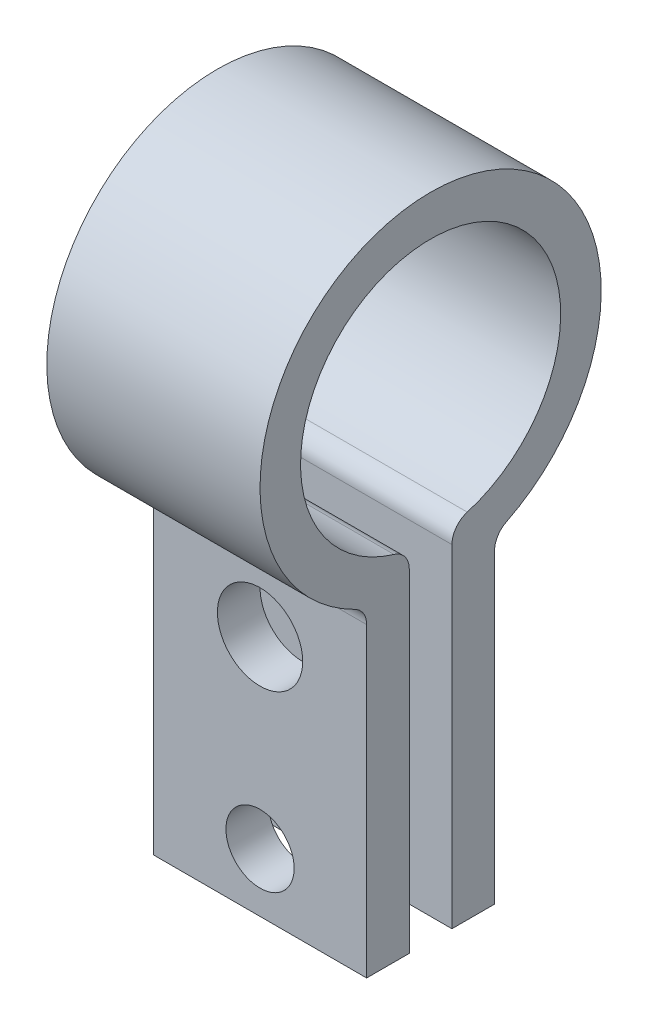
from build123d import *

# Parameters (mm, degrees)
BOSS_EXTRUDE1_DEPTH = 5
FILLET1_R           = 1
SKETCH3_R           = 1.6
SKETCH3_R_2         = 2
CUT_EXTRUDE1_DEPTH  = 26.465387384


with BuildPart() as part:
    # Sketch1 → Boss-Extrude1 (new, symmetric)
    with BuildSketch(Plane(origin=(0, 0, 0), x_dir=(0, 0, -1), z_dir=(1, 0, 0))):
        with BuildLine():
            Line((-3, -7.416198487), (-3, -22.416198487))
            Line((-3, -22.416198487), (-1, -22.416198487))
            Line((-1, -22.416198487), (-1, -6.017474553))
            ThreePointArc((-1, -6.017474553), (0, 6.1), (1, -6.017474553))
            Line((1, -6.017474553), (1, -22.416198487))
            Line((1, -22.416198487), (3, -22.416198487))
            Line((3, -22.416198487), (3, -7.416198487))
            ThreePointArc((3, -7.416198487), (0, 8), (-3, -7.416198487))
        make_face()
    extrude(amount=BOSS_EXTRUDE1_DEPTH, both=True)

    # Fillet1
    fillet1_edges = [part.edges().sort_by_distance(p)[0] for p in [
        (0, -6.017474553, 1),
        (0, -7.416198487, 3),
        (0, -7.416198487, -3),
        (0, -6.017474553, -1),
    ]]
    fillet(fillet1_edges, radius=FILLET1_R)

    # Sketch3 → Cut-Extrude1 (cut, through all)
    with BuildSketch(Plane.XY.offset(3)):
        with Locations((0, -19.666198487)):
            Circle(SKETCH3_R)
        with Locations((0, -11.062257748)):
            Circle(SKETCH3_R_2)
    extrude(amount=-CUT_EXTRUDE1_DEPTH, mode=Mode.SUBTRACT)


solid = part.part
